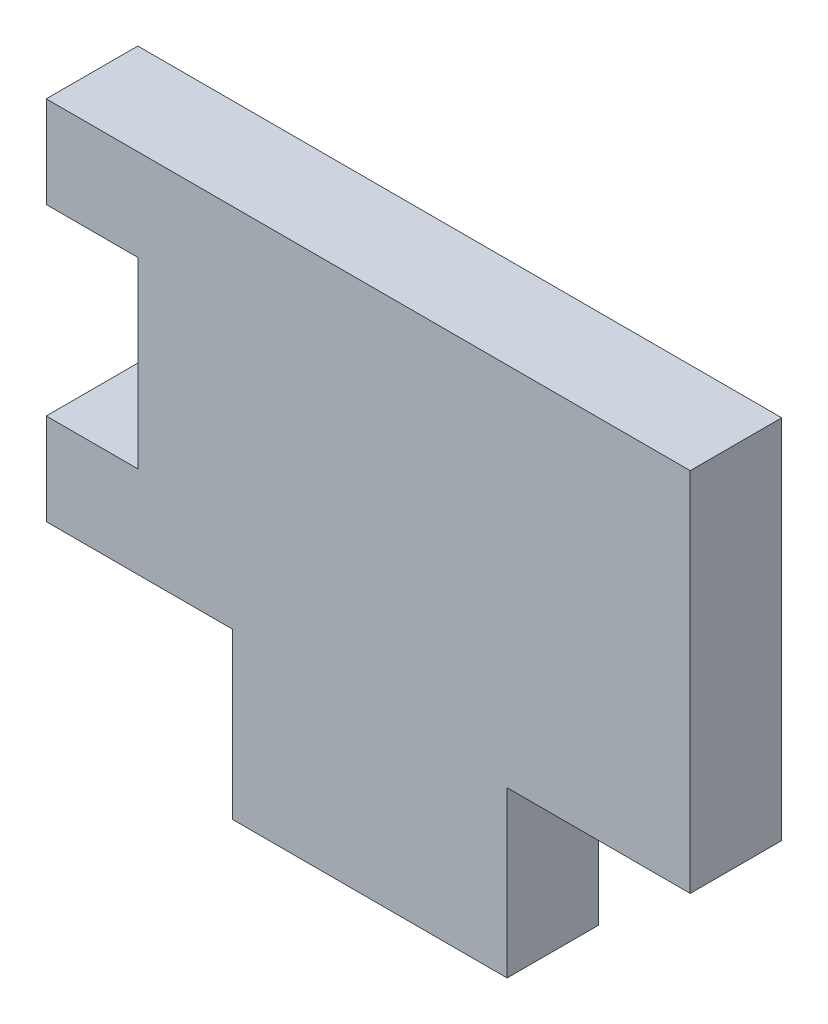
from build123d import *

# Parameters (mm, degrees)
BOSS_EXTRUDE1_DEPTH = 5


with BuildPart() as part:
    # Sketch1 → Boss-Extrude1 (new body)
    with BuildSketch(Plane.XY):
        Polygon((10, -6.062552828), (25, -6.062552828), (25, 2.937447172), (35, 2.937447172), (35, 22.937447172), (-0.173985327, 22.937447172), (-0.173985327, 17.937447172), (4.826014673, 17.937447172), (4.826014673, 17.437447172), (4.826014673, 7.937447172), (-0.173985327, 7.937447172), (-0.173985327, 2.937447172), (10, 2.937447172), align=None)
    extrude(amount=BOSS_EXTRUDE1_DEPTH)


solid = part.part
